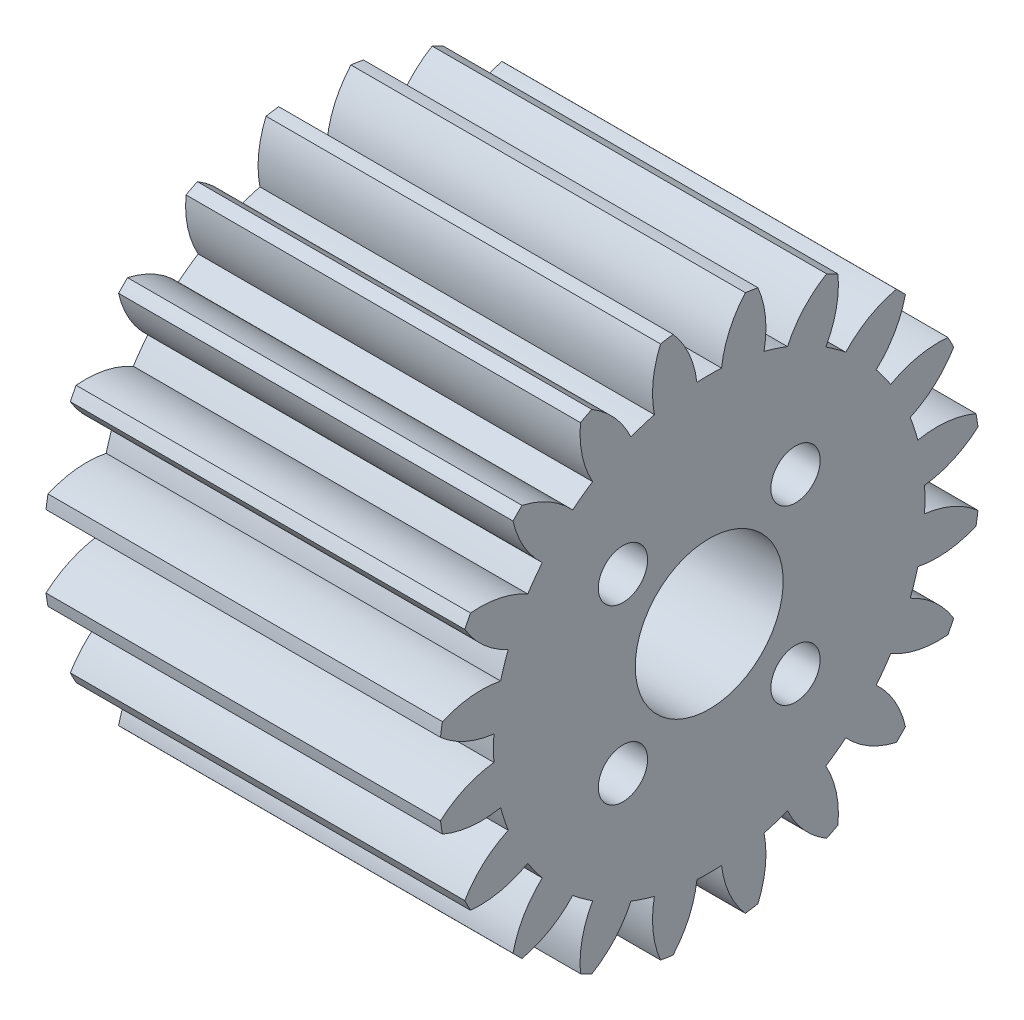
from build123d import *

# Parameters (mm, degrees)
BASPROSKE_W        = 16
BASPROSKE_H        = 11
SKETCH1_R          = 1
CUT_EXTRUDE1_DEPTH = 30
TOOTHCUT_DEPTH     = 23.315913604
TEETHCUTS_COUNT    = 20
TEETHCUTS_ANGLE    = 342
BORSKE_R           = 3
BORE_DEPTH         = 50.0000508


with BuildPart() as part:
    # BasProSke → Base-Revolve (revolve)
    with BuildSketch(Plane(origin=(0, 0, 0), x_dir=(1, 0, 0), z_dir=(0, 1, 0)), mode=Mode.PRIVATE) as base_revolve_sk:
        with Locations((8, 5.5)):
            Rectangle(BASPROSKE_W, BASPROSKE_H)
    revolve(base_revolve_sk.sketch.rotate(Axis((-10, 0, 0), (1, 0, 0)), 180), axis=Axis((-10, 0, 0), (1, 0, 0)))

    # Sketch1 → Cut-Extrude1 (cut)
    with BuildSketch(Plane(origin=(16, 0, 0), x_dir=(0, 0, -1), z_dir=(1, 0, 0))):
        with Locations((3.5, 3.5)):
            Circle(SKETCH1_R)
        with Locations((-3.5, 3.5)):
            Circle(SKETCH1_R)
        with Locations((-3.5, -3.5)):
            Circle(SKETCH1_R)
        with Locations((3.5, -3.5)):
            Circle(SKETCH1_R)
    extrude(amount=-CUT_EXTRUDE1_DEPTH, mode=Mode.SUBTRACT)

    # TooCutSke → ToothCut (cut, through all)
    with BuildSketch(Plane(origin=(0, 0, 0), x_dir=(0, 0, -1), z_dir=(1, 0, 0))):
        with BuildLine():
            ThreePointArc((0.499924007, 8.734705318), (0, 8.749), (-0.499924007, 8.734705318))
            ThreePointArc((-0.499924007, 8.734705318), (-0.824302243, 9.905497836), (-1.485192705, 10.924909509))
            ThreePointArc((-1.485192705, 10.924909509), (0, 11.0254), (1.485192705, 10.924909509))
            ThreePointArc((1.485192705, 10.924909509), (0.824302243, 9.905497836), (0.499924007, 8.734705318))
        make_face()
    toothcut = extrude(amount=TOOTHCUT_DEPTH, mode=Mode.SUBTRACT)

    # TeethCuts: ToothCut ×20 about axis
    teethcuts_axis = Axis((-10, 0, 0), (1, 0, 0))
    for i in range(1, TEETHCUTS_COUNT):
        add(toothcut.rotate(teethcuts_axis, i * TEETHCUTS_ANGLE / (TEETHCUTS_COUNT - 1)), mode=Mode.SUBTRACT)

    # BorSke → Bore (cut, symmetric)
    with BuildSketch(Plane(origin=(0, 0, 0), x_dir=(0, 0, -1), z_dir=(1, 0, 0))):
        with Locations(Location((0, 0, 0), (0, 0, 180))):
            Circle(BORSKE_R)
    extrude(amount=BORE_DEPTH, both=True, mode=Mode.SUBTRACT)


solid = part.part
